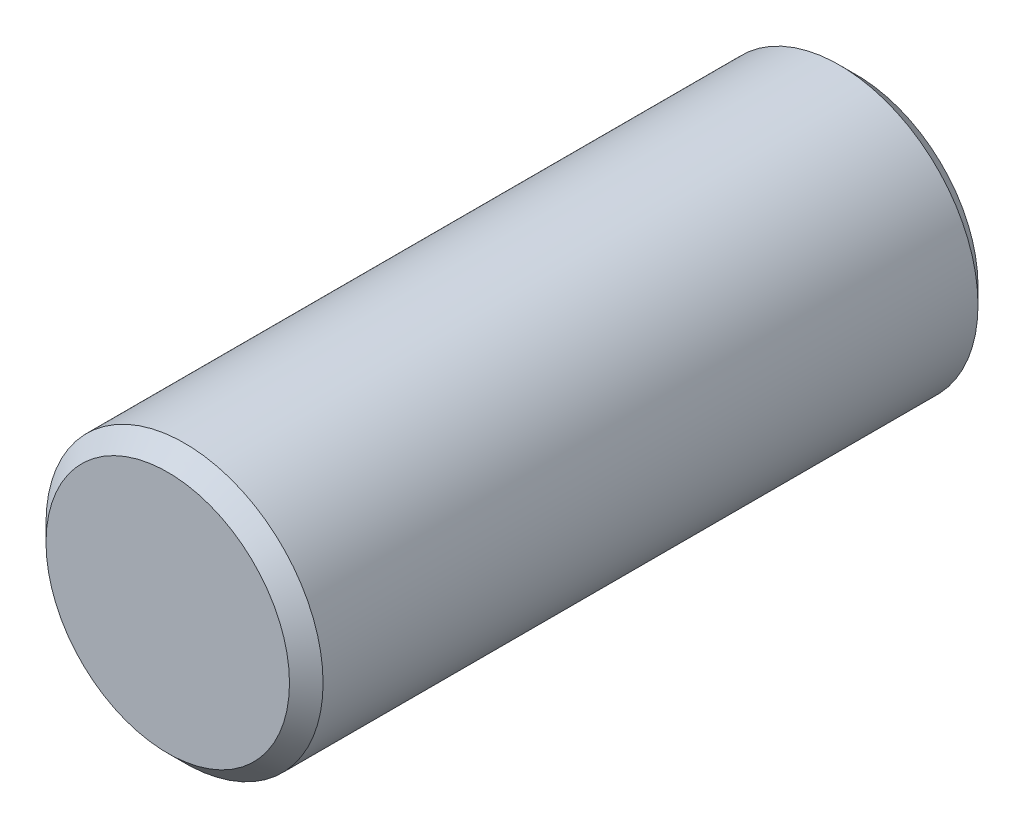
from build123d import *

# Parameters (mm, degrees)
SKETCH1_R           = 16.5
BOSS_EXTRUDE1_DEPTH = 41
CHAMFER1_SIZE       = 2


with BuildPart() as part:
    # Sketch1 → Boss-Extrude1 (new, symmetric)
    with BuildSketch(Plane.XY):
        Circle(SKETCH1_R)
    extrude(amount=BOSS_EXTRUDE1_DEPTH, both=True)

    # Chamfer1
    chamfer1_edges = [part.edges().sort_by_distance(p)[0] for p in [
        (-16.5, 0, -41),
        (-16.5, 0, 41),
    ]]
    chamfer(chamfer1_edges, length=CHAMFER1_SIZE)


solid = part.part
